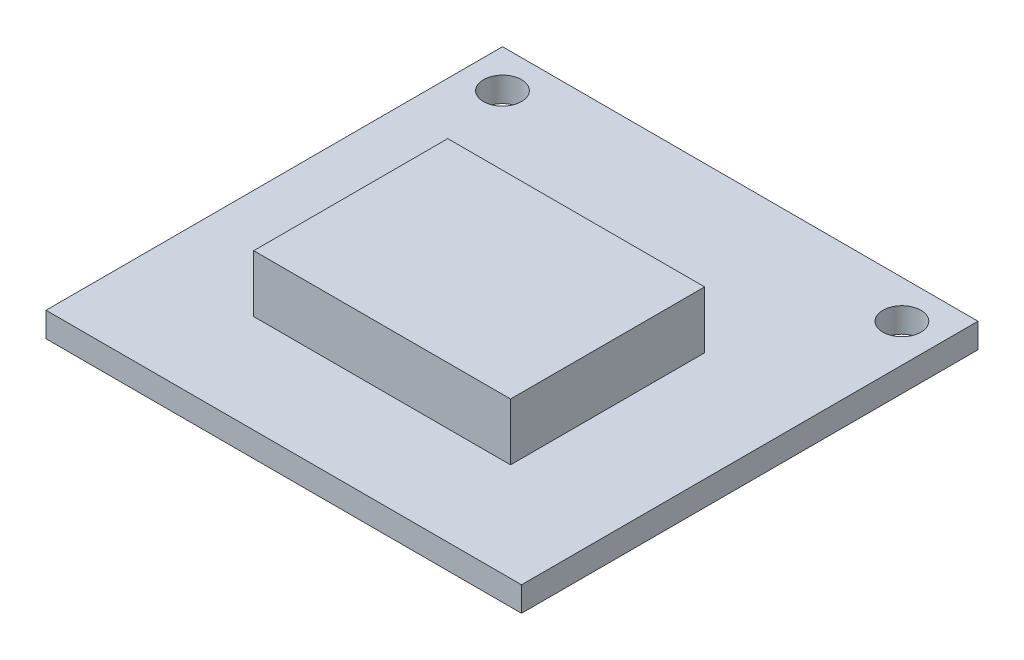
from build123d import *

# Parameters (mm, degrees)
SKETCH1_W           = 25
SKETCH1_H           = 24
SKETCH1_R           = 1
BOSS_EXTRUDE1_DEPTH = 1.3
SKETCH2_W           = 13.502884402
SKETCH2_H           = 10.204469891
BOSS_EXTRUDE2_DEPTH = 3


with BuildPart() as part:
    # Sketch1 → Boss-Extrude1 (new body)
    with BuildSketch(Plane(origin=(0, 0, 0), x_dir=(1, 0, 0), z_dir=(0, 1, 0))):
        Rectangle(SKETCH1_W, SKETCH1_H)
        with Locations(Location((10.5, 10, 0), (0, 0, 270))):
            Circle(SKETCH1_R, mode=Mode.SUBTRACT)
        with Locations(Location((-10.5, 10, 0), (0, 0, 90))):
            Circle(SKETCH1_R, mode=Mode.SUBTRACT)
    extrude(amount=BOSS_EXTRUDE1_DEPTH)

    # Sketch2 → Boss-Extrude2 (add)
    with BuildSketch(Plane(origin=(0, 1.3, 0), x_dir=(1, 0, 0), z_dir=(0, 1, 0))):
        with Locations((0, -1.726513846)):
            Rectangle(SKETCH2_W, SKETCH2_H)
    extrude(amount=BOSS_EXTRUDE2_DEPTH)


solid = part.part
